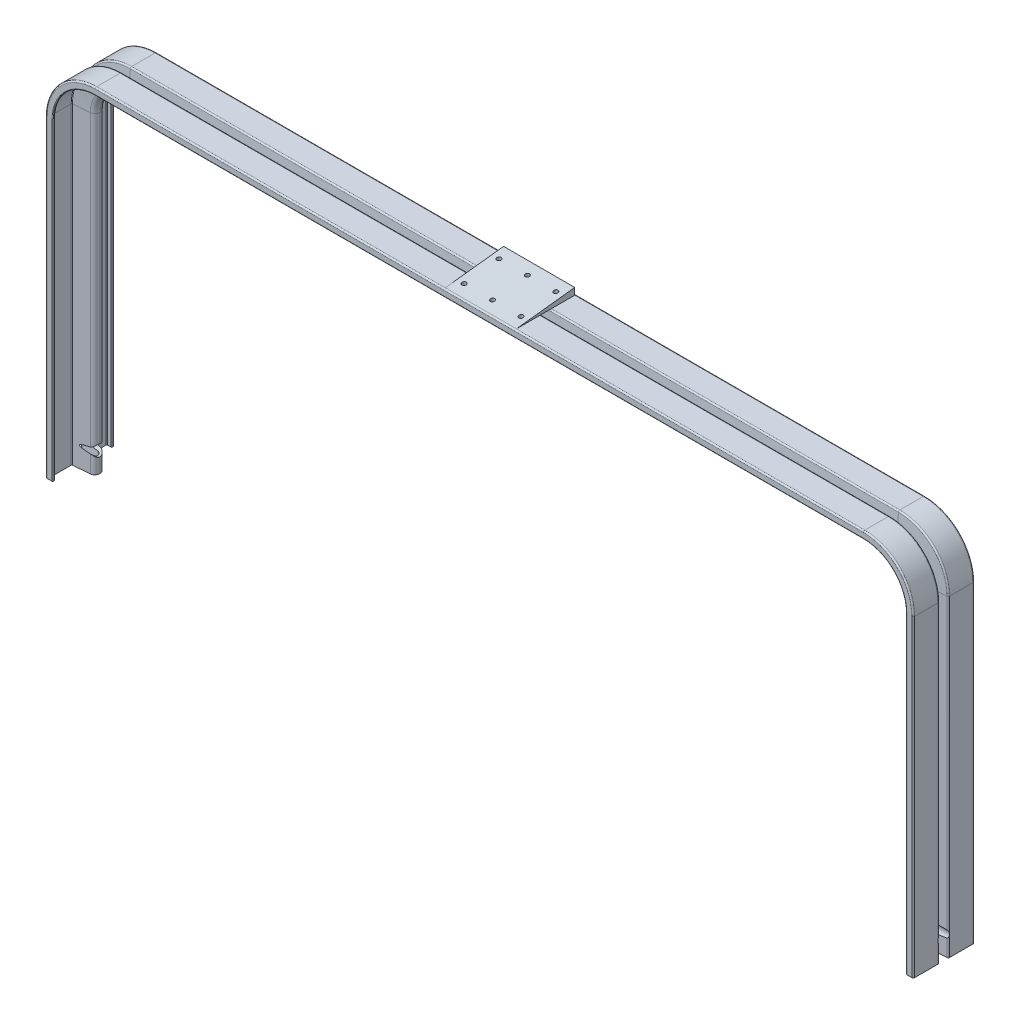
from build123d import *

# Parameters (mm, degrees)
SALIENTE_EXTRUIR1_DEPTH = 270
REVOLUCI_N1_ANGLE       = 90
SALIENTE_EXTRUIR2_DEPTH = 220
CROQUIS11_R             = 4.05
CORTAR_EXTRUIR1_DEPTH   = 657.513214965
SALIENTE_EXTRUIR3_DEPTH = 25
CROQUIS13_R             = 1.5
CORTAR_EXTRUIR2_DEPTH   = 398.176912869


with BuildPart() as part:
    # Croquis2 → Saliente-Extruir1 (new, symmetric)
    with BuildSketch(Plane(origin=(0, 0, 0), x_dir=(0, 0, -1), z_dir=(1, 0, 0))):
        with BuildLine():
            Line((-2.995207656, 11), (-3.004777082, 11.119617833))
            Line((-3.004777082, 11.119617833), (-3.100877661, 12.32087507))
            ThreePointArc((-3.100877661, 12.32087507), (-3.419366036, 12.975890088), (-4.09769294, 13.241129848))
            Line((-4.09769294, 13.241129848), (-5.827781501, 13.241129848))
            Line((-5.827781501, 13.241129848), (-20.5, 13.241129848))
            ThreePointArc((-20.5, 13.241129848), (-21.207106781, 12.948236629), (-21.5, 12.241129848))
            Line((-21.5, 12.241129848), (-21.5, 8.741129848))
            ThreePointArc((-21.5, 8.741129848), (-21.353553391, 8.387576457), (-21, 8.241129848))
            Line((-21, 8.241129848), (-20.5, 8.241129848))
            ThreePointArc((-20.5, 8.241129848), (-20.146446609, 8.387576457), (-20, 8.741129848))
            Line((-20, 8.741129848), (-20, 11.241129848))
            ThreePointArc((-20, 11.241129848), (-19.853553391, 11.594683238), (-19.5, 11.741129848))
            Line((-19.5, 11.741129848), (-5.827781501, 11.741129848))
            Line((-5.827781501, 11.741129848), (-5.020887836, 11.741129848))
            ThreePointArc((-5.020887836, 11.741129848), (-4.681724384, 11.608509968), (-4.522480197, 11.281002459))
            Line((-4.522480197, 11.281002459), (-4.5, 11))
            Line((-4.5, 11), (-3.597671338, -0.279108278))
            ThreePointArc((-3.597671338, -0.279108278), (-2.482962027, -2.571660842), (-0.108817863, -3.5))
            Line((-0.108817863, -3.5), (0.108817863, -3.5))
            ThreePointArc((0.108817863, -3.5), (2.482962027, -2.571660842), (3.597671338, -0.279108278))
            Line((3.597671338, -0.279108278), (4.5, 11))
            Line((4.5, 11), (4.522480197, 11.281002459))
            ThreePointArc((4.522480197, 11.281002459), (4.681724384, 11.608509968), (5.020887836, 11.741129848))
            Line((5.020887836, 11.741129848), (5.827781501, 11.741129848))
            Line((5.827781501, 11.741129848), (19.5, 11.741129848))
            ThreePointArc((19.5, 11.741129848), (19.853553391, 11.594683238), (20, 11.241129848))
            Line((20, 11.241129848), (20, 8.741129848))
            ThreePointArc((20, 8.741129848), (20.146446609, 8.387576457), (20.5, 8.241129848))
            Line((20.5, 8.241129848), (21, 8.241129848))
            ThreePointArc((21, 8.241129848), (21.353553391, 8.387576457), (21.5, 8.741129848))
            Line((21.5, 8.741129848), (21.5, 12.241129848))
            ThreePointArc((21.5, 12.241129848), (21.207106781, 12.948236629), (20.5, 13.241129848))
            Line((20.5, 13.241129848), (5.827781501, 13.241129848))
            Line((5.827781501, 13.241129848), (4.09769294, 13.241129848))
            ThreePointArc((4.09769294, 13.241129848), (3.419366036, 12.975890088), (3.100877661, 12.32087507))
            Line((3.100877661, 12.32087507), (3.004777082, 11.119617833))
            Line((3.004777082, 11.119617833), (2.995207656, 11))
            Line((2.995207656, 11), (2.10244842, -0.159490445))
            ThreePointArc((2.10244842, -0.159490445), (1.465471671, -1.469520481), (0.108817863, -2))
            Line((0.108817863, -2), (-0.108817863, -2))
            ThreePointArc((-0.108817863, -2), (-1.465471671, -1.469520481), (-2.10244842, -0.159490445))
            Line((-2.10244842, -0.159490445), (-2.995207656, 11))
        make_face()
    extrude(amount=SALIENTE_EXTRUIR1_DEPTH, both=True)

    # Croquis9 → Revolución1 (revolve)
    with BuildSketch(Plane(origin=(270, 0, 0), x_dir=(0, 0, -1), z_dir=(1, 0, 0))):
        with BuildLine():
            Line((-19.5, 11.741129848), (-5.020887836, 11.741129848))
            ThreePointArc((-5.020887836, 11.741129848), (-4.681724384, 11.608509968), (-4.522480197, 11.281002459))
            Line((-4.522480197, 11.281002459), (-3.597671338, -0.279108278))
            ThreePointArc((-3.597671338, -0.279108278), (-2.482962027, -2.571660842), (-0.108817863, -3.5))
            Line((-0.108817863, -3.5), (0.108817863, -3.5))
            ThreePointArc((0.108817863, -3.5), (2.482962027, -2.571660842), (3.597671338, -0.279108278))
            Line((3.597671338, -0.279108278), (4.522480197, 11.281002459))
            ThreePointArc((4.522480197, 11.281002459), (4.681724384, 11.608509968), (5.020887836, 11.741129848))
            Line((5.020887836, 11.741129848), (19.5, 11.741129848))
            ThreePointArc((19.5, 11.741129848), (19.853553391, 11.594683238), (20, 11.241129848))
            Line((20, 11.241129848), (20, 8.741129848))
            ThreePointArc((20, 8.741129848), (20.146446609, 8.387576457), (20.5, 8.241129848))
            Line((20.5, 8.241129848), (21, 8.241129848))
            ThreePointArc((21, 8.241129848), (21.353553391, 8.387576457), (21.5, 8.741129848))
            Line((21.5, 8.741129848), (21.5, 12.241129848))
            ThreePointArc((21.5, 12.241129848), (21.207106781, 12.948236629), (20.5, 13.241129848))
            Line((20.5, 13.241129848), (4.09769294, 13.241129848))
            ThreePointArc((4.09769294, 13.241129848), (3.419366036, 12.975890088), (3.100877661, 12.32087507))
            Line((3.100877661, 12.32087507), (2.10244842, -0.159490445))
            ThreePointArc((2.10244842, -0.159490445), (1.465471671, -1.469520481), (0.108817863, -2))
            Line((0.108817863, -2), (-0.108817863, -2))
            ThreePointArc((-0.108817863, -2), (-1.465471671, -1.469520481), (-2.10244842, -0.159490445))
            Line((-2.10244842, -0.159490445), (-3.100877661, 12.32087507))
            ThreePointArc((-3.100877661, 12.32087507), (-3.419366036, 12.975890088), (-4.09769294, 13.241129848))
            Line((-4.09769294, 13.241129848), (-20.5, 13.241129848))
            ThreePointArc((-20.5, 13.241129848), (-21.207106781, 12.948236629), (-21.5, 12.241129848))
            Line((-21.5, 12.241129848), (-21.5, 8.741129848))
            ThreePointArc((-21.5, 8.741129848), (-21.353553391, 8.387576457), (-21, 8.241129848))
            Line((-21, 8.241129848), (-20.5, 8.241129848))
            ThreePointArc((-20.5, 8.241129848), (-20.146446609, 8.387576457), (-20, 8.741129848))
            Line((-20, 8.741129848), (-20, 11.241129848))
            ThreePointArc((-20, 11.241129848), (-19.853553391, 11.594683238), (-19.5, 11.741129848))
        make_face()
    revoluci_n1 = revolve(axis=Axis((270, -21.758870152, 0.108817863), (0, 0, -1)), revolution_arc=REVOLUCI_N1_ANGLE)

    # Simetría1: Revolución1 across plane
    add(revoluci_n1.mirror(Plane(origin=(0, 0, 0), x_dir=(0, 0, 1), z_dir=(1, 0, 0))))

    # Croquis10 → Saliente-Extruir2 (add)
    with BuildSketch(Plane.XZ.offset(21.758870152)):
        with BuildLine():
            Line((300.5, 21.5), (304, 21.5))
            ThreePointArc((304, 21.5), (304.707106781, 21.207106781), (305, 20.5))
            Line((305, 20.5), (305, 4.09769294))
            ThreePointArc((305, 4.09769294), (304.734760241, 3.419366036), (304.079745222, 3.100877661))
            Line((304.079745222, 3.100877661), (291.599379708, 2.10244842))
            ThreePointArc((291.599379708, 2.10244842), (290.289349671, 1.465471671), (289.758870152, 0.108817863))
            Line((289.758870152, 0.108817863), (289.758870152, -0.108817863))
            ThreePointArc((289.758870152, -0.108817863), (290.289349671, -1.465471671), (291.599379708, -2.10244842))
            Line((291.599379708, -2.10244842), (304.079745222, -3.100877661))
            ThreePointArc((304.079745222, -3.100877661), (304.734760241, -3.419366036), (305, -4.09769294))
            Line((305, -4.09769294), (305, -20.5))
            ThreePointArc((305, -20.5), (304.707106781, -21.207106781), (304, -21.5))
            Line((304, -21.5), (300.5, -21.5))
            ThreePointArc((300.5, -21.5), (300.146446609, -21.353553391), (300, -21))
            Line((300, -21), (300, -20.5))
            ThreePointArc((300, -20.5), (300.146446609, -20.146446609), (300.5, -20))
            Line((300.5, -20), (303, -20))
            ThreePointArc((303, -20), (303.353553391, -19.853553391), (303.5, -19.5))
            Line((303.5, -19.5), (303.5, -5.020887836))
            ThreePointArc((303.5, -5.020887836), (303.36738012, -4.681724384), (303.039872611, -4.522480197))
            Line((303.039872611, -4.522480197), (291.479761874, -3.597671338))
            ThreePointArc((291.479761874, -3.597671338), (289.18720931, -2.482962027), (288.258870152, -0.108817863))
            Line((288.258870152, -0.108817863), (288.258870152, 0.108817863))
            ThreePointArc((288.258870152, 0.108817863), (289.18720931, 2.482962027), (291.479761874, 3.597671338))
            Line((291.479761874, 3.597671338), (303.039872611, 4.522480197))
            ThreePointArc((303.039872611, 4.522480197), (303.36738012, 4.681724384), (303.5, 5.020887836))
            Line((303.5, 5.020887836), (303.5, 19.5))
            ThreePointArc((303.5, 19.5), (303.353553391, 19.853553391), (303, 20))
            Line((303, 20), (300.5, 20))
            ThreePointArc((300.5, 20), (300.146446609, 20.146446609), (300, 20.5))
            Line((300, 20.5), (300, 21))
            ThreePointArc((300, 21), (300.146446609, 21.353553391), (300.5, 21.5))
        make_face()
    saliente_extruir2 = extrude(amount=SALIENTE_EXTRUIR2_DEPTH)

    # Simetría2: Saliente-Extruir2 across plane
    add(saliente_extruir2.mirror(Plane(origin=(0, 0, 0), x_dir=(0, 0, 1), z_dir=(1, 0, 0))))

    # Croquis11 → Cortar-Extruir1 (cut, through all)
    with BuildSketch(Plane.ZY.offset(305)):
        with Locations(Location((0.108817863, -227.429441325, 0), (0, 0, 270))):
            Circle(CROQUIS11_R)
    extrude(amount=-CORTAR_EXTRUIR1_DEPTH, mode=Mode.SUBTRACT)

    # Croquis12 → Saliente-Extruir3 (add, symmetric)
    with BuildSketch(Plane(origin=(0, 0, 0), x_dir=(0, 0, -1), z_dir=(1, 0, 0))):
        Polygon((20.5, 13.241129848), (20.5, 17.984991703), (-20.5, 13.241129848), align=None)
    extrude(amount=SALIENTE_EXTRUIR3_DEPTH, both=True)

    # Croquis13 → Cortar-Extruir2 (cut, through all)
    with BuildSketch(Plane.XZ.offset(-11.741129848)):
        with Locations(Location((0, 12.26, 0), (0, 0, 270))):
            Circle(CROQUIS13_R)
        with Locations(Location((20, 12.26, 0), (0, 0, 270))):
            Circle(CROQUIS13_R)
        with Locations(Location((-20, 12.26, 0), (0, 0, 90))):
            Circle(CROQUIS13_R)
        with Locations(Location((20, -12.26, 0), (0, 0, 90))):
            Circle(CROQUIS13_R)
        with Locations(Location((0, -12.26, 0), (0, 0, 90))):
            Circle(CROQUIS13_R)
        with Locations(Location((-20, -12.26, 0), (0, 0, 270))):
            Circle(CROQUIS13_R)
    extrude(amount=-CORTAR_EXTRUIR2_DEPTH, mode=Mode.SUBTRACT)


solid = part.part
